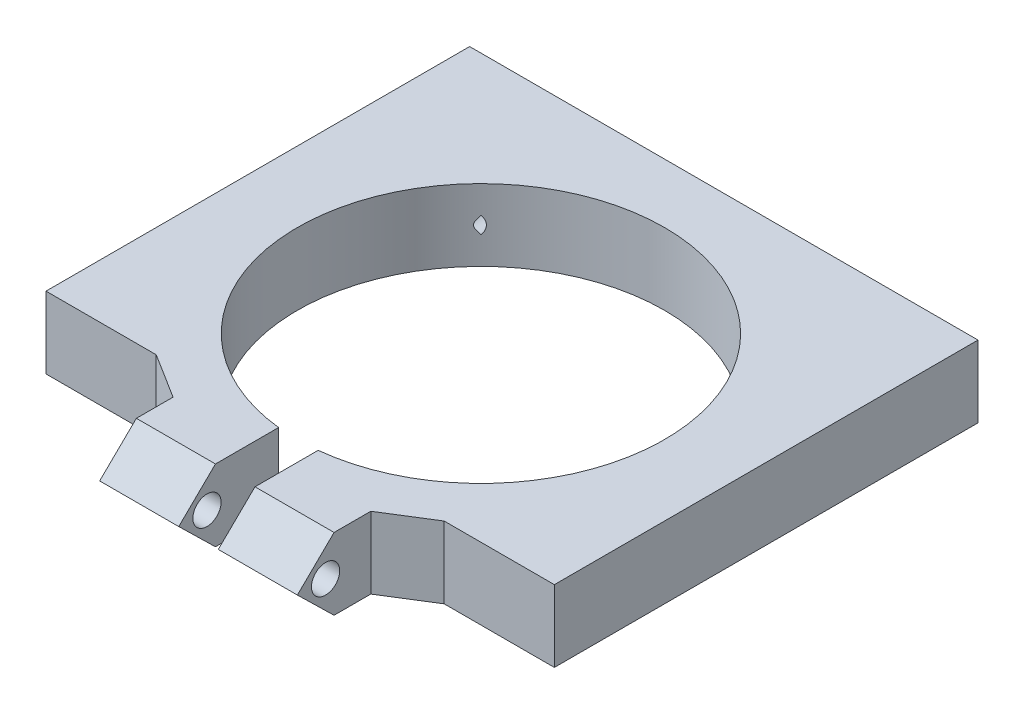
from build123d import *

# Parameters (mm, degrees)
ESBO_O1_W                          = 90
ESBO_O1_H                          = 93
RESSALTO_EXTRUS_O1_DEPTH           = 12.7
ESBO_O3_R                          = 32.51
CORTE_EXTRUS_O2_DEPTH              = 66.943460631
CORTE_EXTRUS_O4_REACH              = 67.943
ESBO_O5_W                          = 27.5
ESBO_O5_H                          = 13
CORTE_EXTRUS_O5_REACH              = 67.943
ESBO_O6_W                          = 7
ESBO_O6_H                          = 26.329700269
CORTE_EXTRUS_O6_REACH              = 80.929
ESBO_O7_R                          = 2.5
CORTE_EXTRUS_O7_REACH              = 80.929
CORTE_EXTRUS_O8_DEPTH              = 66.943460631
TALADRO_DE_MARGEN_PARA_00001_D     = 5
TALADRO_DE_MARGEN_PARA_00001_DEPTH = 20
TALADRO_DE_MARGEN_PARA_00001_TIP   = 1.502151548


with BuildPart() as part:
    # Esboço1 → Ressalto-extrusão1 (new body)
    with BuildSketch(Plane(origin=(0, 0, 0), x_dir=(1, 0, 0), z_dir=(0, 1, 0))):
        Rectangle(ESBO_O1_W, ESBO_O1_H)
    extrude(amount=RESSALTO_EXTRUS_O1_DEPTH)

    # Esboço3 → Corte-extrusão2 (cut, through all)
    with BuildSketch(Plane(origin=(0, 12.7, 0), x_dir=(1, 0, 0), z_dir=(0, 1, 0))):
        with Locations(Location((0, 3.5, 0), (0, 0, 270))):
            Circle(ESBO_O3_R)
    extrude(amount=-CORTE_EXTRUS_O2_DEPTH, mode=Mode.SUBTRACT)

    # Esboço5 → Corte-extrusão4 (cut, up to next)
    with BuildSketch(Plane(origin=(0, 12.7, 0), x_dir=(1, 0, 0), z_dir=(0, 1, 0)), mode=Mode.PRIVATE) as corte_extrus_o4_sk1:
        with Locations((31.25, -40)):
            Rectangle(ESBO_O5_W, ESBO_O5_H)
    corte_extrus_o4_tool1 = extrude(corte_extrus_o4_sk1.sketch, amount=-CORTE_EXTRUS_O4_REACH, mode=Mode.PRIVATE) & part.part
    # Esboço5 → Corte-extrusão4 (cut, up to next)
    with BuildSketch(Plane(origin=(0, 12.7, 0), x_dir=(1, 0, 0), z_dir=(0, 1, 0)), mode=Mode.PRIVATE) as corte_extrus_o4_sk2:
        with Locations((-31.25, -40)):
            Rectangle(ESBO_O5_W, ESBO_O5_H)
    corte_extrus_o4_tool2 = extrude(corte_extrus_o4_sk2.sketch, amount=-CORTE_EXTRUS_O4_REACH, mode=Mode.PRIVATE) & part.part
    add(corte_extrus_o4_tool1.solids().sort_by_distance((31.25, 12.7, 40))[0], mode=Mode.SUBTRACT)
    add(corte_extrus_o4_tool2.solids().sort_by_distance((-31.25, 12.7, 40))[0], mode=Mode.SUBTRACT)

    # Esboço6 → Corte-extrusão5 (cut, up to next)
    with BuildSketch(Plane(origin=(0, 12.7, 0), x_dir=(1, 0, 0), z_dir=(0, 1, 0)), mode=Mode.PRIVATE) as corte_extrus_o5_sk1:
        with Locations((0, -33.335149866)):
            Rectangle(ESBO_O6_W, ESBO_O6_H)
    corte_extrus_o5_tool1 = extrude(corte_extrus_o5_sk1.sketch, amount=-CORTE_EXTRUS_O5_REACH, mode=Mode.PRIVATE) & part.part
    add(corte_extrus_o5_tool1.solids().sort_by_distance((0, 12.7, 33.33515))[0], mode=Mode.SUBTRACT)

    # Corte-extrusão6: up to this face of the body (flat: up to its plane)
    corte_extrus_o6_end = Plane(part.part.faces().sort_by_distance((17.5, 6.35, 40))[0])
    # Esboço7 → Corte-extrusão6 (cut, up to the picked face)
    with BuildSketch(Plane.ZY.offset(17.5), mode=Mode.PRIVATE) as corte_extrus_o6_sk1:
        with Locations((41.5, 6.35)):
            Circle(ESBO_O7_R)
    corte_extrus_o6_tool1 = split(extrude(corte_extrus_o6_sk1.sketch, amount=-CORTE_EXTRUS_O6_REACH, mode=Mode.PRIVATE), bisect_by=corte_extrus_o6_end, keep=Keep.BOTH, mode=Mode.PRIVATE)
    add(corte_extrus_o6_tool1.solids().sort_by(Axis((-17.5, 6.35, 41.5), (1, 0, 0)))[0], mode=Mode.SUBTRACT)

    # Corte-extrusão7: up to this face of the body (flat: up to its plane)
    corte_extrus_o7_end = Plane(part.part.faces().sort_by_distance((17.5, 12.518261176, 40))[0])
    # Esboço8 → Corte-extrusão7 (cut, up to the picked face)
    with BuildSketch(Plane.ZY.offset(17.5), mode=Mode.PRIVATE) as corte_extrus_o7_sk1:
        Polygon((46.5, 12.7), (40, 12.7), (46.5, 6.35), align=None)
    corte_extrus_o7_tool1 = split(extrude(corte_extrus_o7_sk1.sketch, amount=-CORTE_EXTRUS_O7_REACH, mode=Mode.PRIVATE), bisect_by=corte_extrus_o7_end, keep=Keep.BOTH, mode=Mode.PRIVATE)
    # Esboço8 → Corte-extrusão7 (cut, up to the picked face)
    with BuildSketch(Plane.ZY.offset(17.5), mode=Mode.PRIVATE) as corte_extrus_o7_sk2:
        Polygon((46.5, 0), (46.5, 6.35), (40, 0), align=None)
    corte_extrus_o7_tool2 = split(extrude(corte_extrus_o7_sk2.sketch, amount=-CORTE_EXTRUS_O7_REACH, mode=Mode.PRIVATE), bisect_by=corte_extrus_o7_end, keep=Keep.BOTH, mode=Mode.PRIVATE)
    add(corte_extrus_o7_tool1.solids().sort_by(Axis((-17.5, 10.583333, 44.333333), (1, 0, 0)))[0], mode=Mode.SUBTRACT)
    add(corte_extrus_o7_tool2.solids().sort_by(Axis((-17.5, 2.116667, 44.333333), (1, 0, 0)))[0], mode=Mode.SUBTRACT)

    # Esboço9 → Corte-extrusão8 (cut, through all)
    with BuildSketch(Plane(origin=(0, 12.7, 0), x_dir=(-1, 0, 0), z_dir=(0, 1, 0))):
        Polygon((45, 28.5), (25.5, 28.5), (17.5, 33.5), (25.5, 33.5), (45, 33.5), align=None)
        Polygon((-45, 33.5), (-25.5, 33.5), (-17.5, 33.5), (-25.5, 28.5), (-45, 28.5), align=None)
    extrude(amount=-CORTE_EXTRUS_O8_DEPTH, mode=Mode.SUBTRACT)

    # Taladro de margen para #00001
    with Locations(Plane(origin=(0, 0, -46.5), x_dir=(-1, 0, 0), z_dir=(0, 0, -1))):
        with Locations((-40, 6.35), (-25, 6.35), (40, 6.35), (25, 6.35)):
            Hole(TALADRO_DE_MARGEN_PARA_00001_D / 2, depth=TALADRO_DE_MARGEN_PARA_00001_DEPTH)
            with Locations((0, 0, -(TALADRO_DE_MARGEN_PARA_00001_DEPTH + TALADRO_DE_MARGEN_PARA_00001_TIP / 2))):  # 118° drill point
                Cone(0, TALADRO_DE_MARGEN_PARA_00001_D / 2, TALADRO_DE_MARGEN_PARA_00001_TIP, mode=Mode.SUBTRACT)


solid = part.part
